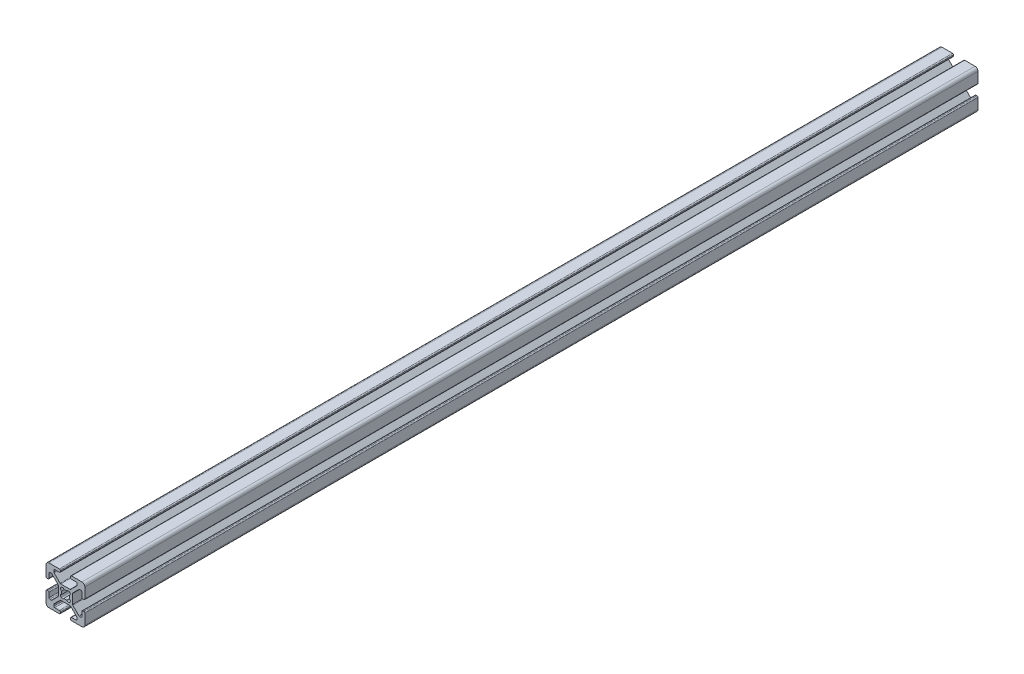
from build123d import *

# Parameters (mm, degrees)
EXTRUDE1_DEPTH = 460


with BuildPart() as part:
    # Sketch1 → Extrude1 (new body)
    with BuildSketch(Plane.XY):
        with BuildLine():
            Line((-5.032287798, -0.341059771), (-5.516287798, -0.341059771))
            ThreePointArc((-5.516287798, -0.341059771), (-5.875498042, -0.192270016), (-6.024287798, 0.166940229))
            Line((-6.024287798, 0.166940229), (-6.024287798, 2.515940229))
            ThreePointArc((-6.024287798, 2.515940229), (-6.173077553, 2.875150474), (-6.532287798, 3.023940229))
            Line((-6.532287798, 3.023940229), (-7.258207136, 3.023940229))
            ThreePointArc((-7.258207136, 3.023940229), (-7.45261032, 2.985271032), (-7.617417381, 2.875150474))
            Line((-7.617417381, 2.875150474), (-10.720498042, -0.227930187))
            ThreePointArc((-10.720498042, -0.227930187), (-10.8306186, -0.392737249), (-10.869287798, -0.587140432))
            Line((-10.869287798, -0.587140432), (-10.869287798, -5.354979109))
            ThreePointArc((-10.869287798, -5.354979109), (-10.8306186, -5.549382293), (-10.720498042, -5.714189354))
            Line((-10.720498042, -5.714189354), (-7.617417381, -8.817270016))
            ThreePointArc((-7.617417381, -8.817270016), (-7.45261032, -8.927390573), (-7.258207136, -8.966059771))
            Line((-7.258207136, -8.966059771), (-6.532287798, -8.966059771))
            ThreePointArc((-6.532287798, -8.966059771), (-6.173077553, -8.817270016), (-6.024287798, -8.458059771))
            Line((-6.024287798, -8.458059771), (-6.024287798, -6.109059771))
            ThreePointArc((-6.024287798, -6.109059771), (-5.875498042, -5.749849526), (-5.516287798, -5.601059771))
            Line((-5.516287798, -5.601059771), (-5.032287798, -5.601059771))
            ThreePointArc((-5.032287798, -5.601059771), (-4.673077553, -5.749849526), (-4.524287798, -6.109059771))
            Line((-4.524287798, -6.109059771), (-4.524287798, -11.471059771))
            ThreePointArc((-4.524287798, -11.471059771), (-4.963627626, -12.531719943), (-6.024287798, -12.971059771))
            Line((-6.024287798, -12.971059771), (-11.386287798, -12.971059771))
            ThreePointArc((-11.386287798, -12.971059771), (-11.745498042, -12.822270016), (-11.894287798, -12.463059771))
            Line((-11.894287798, -12.463059771), (-11.894287798, -11.979059771))
            ThreePointArc((-11.894287798, -11.979059771), (-11.745498042, -11.619849526), (-11.386287798, -11.471059771))
            Line((-11.386287798, -11.471059771), (-9.037287798, -11.471059771))
            ThreePointArc((-9.037287798, -11.471059771), (-8.678077553, -11.322270016), (-8.529287798, -10.963059771))
            Line((-8.529287798, -10.963059771), (-8.529287798, -10.237140432))
            ThreePointArc((-8.529287798, -10.237140432), (-8.567956995, -10.042737249), (-8.678077553, -9.877930187))
            Line((-8.678077553, -9.877930187), (-11.781158214, -6.774849526))
            ThreePointArc((-11.781158214, -6.774849526), (-11.945965275, -6.664728968), (-12.140368459, -6.626059771))
            Line((-12.140368459, -6.626059771), (-16.908207136, -6.626059771))
            ThreePointArc((-16.908207136, -6.626059771), (-17.10261032, -6.664728968), (-17.267417381, -6.774849526))
            Line((-17.267417381, -6.774849526), (-20.370498042, -9.877930187))
            ThreePointArc((-20.370498042, -9.877930187), (-20.4806186, -10.042737249), (-20.519287798, -10.237140432))
            Line((-20.519287798, -10.237140432), (-20.519287798, -10.963059771))
            ThreePointArc((-20.519287798, -10.963059771), (-20.370498042, -11.322270016), (-20.011287798, -11.471059771))
            Line((-20.011287798, -11.471059771), (-17.662287798, -11.471059771))
            ThreePointArc((-17.662287798, -11.471059771), (-17.303077553, -11.619849526), (-17.154287798, -11.979059771))
            Line((-17.154287798, -11.979059771), (-17.154287798, -12.463059771))
            ThreePointArc((-17.154287798, -12.463059771), (-17.303077553, -12.822270016), (-17.662287798, -12.971059771))
            Line((-17.662287798, -12.971059771), (-23.024287798, -12.971059771))
            ThreePointArc((-23.024287798, -12.971059771), (-24.084947969, -12.531719943), (-24.524287798, -11.471059771))
            Line((-24.524287798, -11.471059771), (-24.524287798, -6.109059771))
            ThreePointArc((-24.524287798, -6.109059771), (-24.375498042, -5.749849526), (-24.016287798, -5.601059771))
            Line((-24.016287798, -5.601059771), (-23.532287798, -5.601059771))
            ThreePointArc((-23.532287798, -5.601059771), (-23.173077553, -5.749849526), (-23.024287798, -6.109059771))
            Line((-23.024287798, -6.109059771), (-23.024287798, -8.458059771))
            ThreePointArc((-23.024287798, -8.458059771), (-22.875498042, -8.817270016), (-22.516287798, -8.966059771))
            Line((-22.516287798, -8.966059771), (-21.790368459, -8.966059771))
            ThreePointArc((-21.790368459, -8.966059771), (-21.595965275, -8.927390573), (-21.431158214, -8.817270016))
            Line((-21.431158214, -8.817270016), (-18.328077553, -5.714189354))
            ThreePointArc((-18.328077553, -5.714189354), (-18.217956995, -5.549382293), (-18.179287798, -5.354979109))
            Line((-18.179287798, -5.354979109), (-18.179287798, -0.587140432))
            ThreePointArc((-18.179287798, -0.587140432), (-18.217956995, -0.392737249), (-18.328077553, -0.227930187))
            Line((-18.328077553, -0.227930187), (-21.431158214, 2.875150474))
            ThreePointArc((-21.431158214, 2.875150474), (-21.595965275, 2.985271032), (-21.790368459, 3.023940229))
            Line((-21.790368459, 3.023940229), (-22.516287798, 3.023940229))
            ThreePointArc((-22.516287798, 3.023940229), (-22.875498042, 2.875150474), (-23.024287798, 2.515940229))
            Line((-23.024287798, 2.515940229), (-23.024287798, 0.166940229))
            ThreePointArc((-23.024287798, 0.166940229), (-23.173077553, -0.192270016), (-23.532287798, -0.341059771))
            Line((-23.532287798, -0.341059771), (-24.016287798, -0.341059771))
            ThreePointArc((-24.016287798, -0.341059771), (-24.375498042, -0.192270016), (-24.524287798, 0.166940229))
            Line((-24.524287798, 0.166940229), (-24.524287798, 5.528940229))
            ThreePointArc((-24.524287798, 5.528940229), (-24.084947969, 6.589600401), (-23.024287798, 7.028940229))
            Line((-23.024287798, 7.028940229), (-17.662287798, 7.028940229))
            ThreePointArc((-17.662287798, 7.028940229), (-17.303077553, 6.880150474), (-17.154287798, 6.520940229))
            Line((-17.154287798, 6.520940229), (-17.154287798, 6.036940229))
            ThreePointArc((-17.154287798, 6.036940229), (-17.303077553, 5.677729984), (-17.662287798, 5.528940229))
            Line((-17.662287798, 5.528940229), (-20.011287798, 5.528940229))
            ThreePointArc((-20.011287798, 5.528940229), (-20.370498042, 5.380150474), (-20.519287798, 5.020940229))
            Line((-20.519287798, 5.020940229), (-20.519287798, 4.295020891))
            ThreePointArc((-20.519287798, 4.295020891), (-20.4806186, 4.100617707), (-20.370498042, 3.935810646))
            Line((-20.370498042, 3.935810646), (-17.267417381, 0.832729984))
            ThreePointArc((-17.267417381, 0.832729984), (-17.10261032, 0.722609427), (-16.908207136, 0.683940229))
            Line((-16.908207136, 0.683940229), (-12.140368459, 0.683940229))
            ThreePointArc((-12.140368459, 0.683940229), (-11.945965275, 0.722609427), (-11.781158214, 0.832729984))
            Line((-11.781158214, 0.832729984), (-8.678077553, 3.935810646))
            ThreePointArc((-8.678077553, 3.935810646), (-8.567956995, 4.100617707), (-8.529287798, 4.295020891))
            Line((-8.529287798, 4.295020891), (-8.529287798, 5.020940229))
            ThreePointArc((-8.529287798, 5.020940229), (-8.678077553, 5.380150474), (-9.037287798, 5.528940229))
            Line((-9.037287798, 5.528940229), (-11.386287798, 5.528940229))
            ThreePointArc((-11.386287798, 5.528940229), (-11.745498042, 5.677729984), (-11.894287798, 6.036940229))
            Line((-11.894287798, 6.036940229), (-11.894287798, 6.520940229))
            ThreePointArc((-11.894287798, 6.520940229), (-11.745498042, 6.880150474), (-11.386287798, 7.028940229))
            Line((-11.386287798, 7.028940229), (-6.024287798, 7.028940229))
            ThreePointArc((-6.024287798, 7.028940229), (-4.963627626, 6.589600401), (-4.524287798, 5.528940229))
            Line((-4.524287798, 5.528940229), (-4.524287798, 0.166940229))
            ThreePointArc((-4.524287798, 0.166940229), (-4.673077553, -0.192270016), (-5.032287798, -0.341059771))
        make_face()
        with BuildLine():
            Line((-12.399386954, -5.275565737), (-12.219781831, -5.095960615))
            ThreePointArc((-12.219781831, -5.095960615), (-12.018349781, -4.327527582), (-12.589154291, -3.775036489))
            ThreePointArc((-12.589154291, -3.775036489), (-12.428787798, -2.971059771), (-12.589154291, -2.167083053))
            ThreePointArc((-12.589154291, -2.167083053), (-12.018349781, -1.61459196), (-12.219781831, -0.846158927))
            Line((-12.219781831, -0.846158927), (-12.399386954, -0.666553805))
            ThreePointArc((-12.399386954, -0.666553805), (-13.167819987, -0.465121754), (-13.72031108, -1.035926265))
            ThreePointArc((-13.72031108, -1.035926265), (-14.524287798, -0.875559771), (-15.328264516, -1.035926265))
            ThreePointArc((-15.328264516, -1.035926265), (-15.880755608, -0.465121754), (-16.649188641, -0.666553805))
            Line((-16.649188641, -0.666553805), (-16.828793764, -0.846158927))
            ThreePointArc((-16.828793764, -0.846158927), (-17.030225814, -1.61459196), (-16.459421304, -2.167083053))
            ThreePointArc((-16.459421304, -2.167083053), (-16.619787798, -2.971059771), (-16.459421304, -3.775036489))
            ThreePointArc((-16.459421304, -3.775036489), (-17.030225814, -4.327527582), (-16.828793764, -5.095960615))
            Line((-16.828793764, -5.095960615), (-16.649188641, -5.275565737))
            ThreePointArc((-16.649188641, -5.275565737), (-15.880755608, -5.476997788), (-15.328264516, -4.906193277))
            ThreePointArc((-15.328264516, -4.906193277), (-14.524287798, -5.066559771), (-13.72031108, -4.906193277))
            ThreePointArc((-13.72031108, -4.906193277), (-13.167819987, -5.476997788), (-12.399386954, -5.275565737))
        make_face(mode=Mode.SUBTRACT)
    extrude(amount=EXTRUDE1_DEPTH)


solid = part.part
